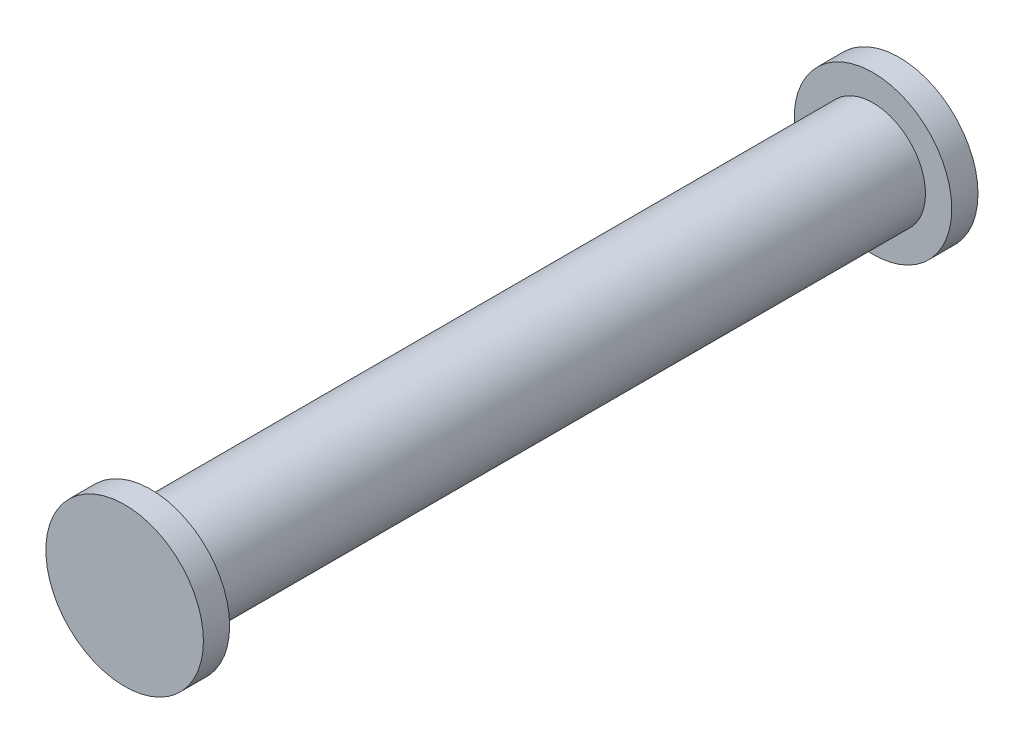
from build123d import *

# Parameters (mm, degrees)
CROQUIS1_R              = 4
SALIENTE_EXTRUIR1_DEPTH = 27.5
CROQUIS2_R              = 6
SALIENTE_EXTRUIR2_DEPTH = 2


with BuildPart() as part:
    # Croquis1 → Saliente-Extruir1 (new, symmetric)
    with BuildSketch(Plane.XY):
        Circle(CROQUIS1_R)
    extrude(amount=SALIENTE_EXTRUIR1_DEPTH, both=True)

    # Croquis2 → Saliente-Extruir2 (add)
    with BuildSketch(Plane.XY.offset(27.5)):
        Circle(CROQUIS2_R)
    saliente_extruir2 = extrude(amount=SALIENTE_EXTRUIR2_DEPTH)

    # Simetría1: Saliente-Extruir2 across plane
    add(saliente_extruir2.mirror(Plane.XY))


solid = part.part
